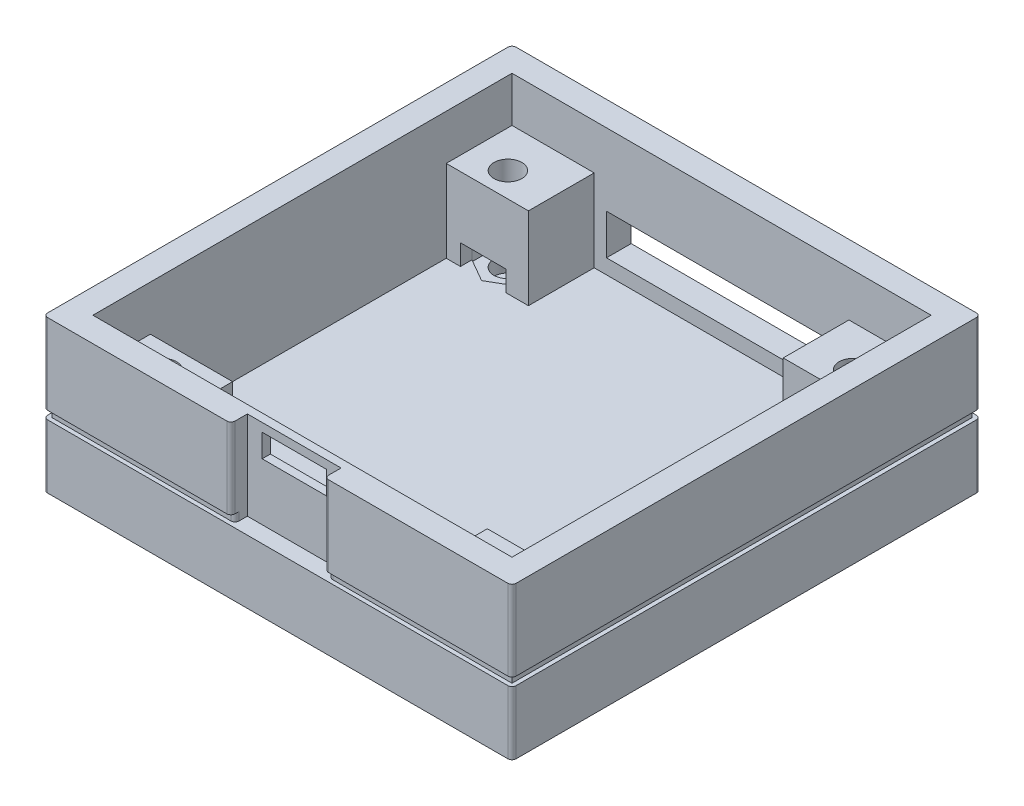
from build123d import *

# Parameters (mm, degrees)
ESQUISSE1_W              = 57
ESQUISSE1_H              = 57
BOSS_EXTRU_1_DEPTH       = 18.5
ESQUISSE2_W              = 51
ESQUISSE2_H              = 51
ENL_V_MAT_EXTRU_1_DEPTH  = 15.5
ESQUISSE4_W              = 10
ESQUISSE4_H              = 8
BOSS_EXTRU_2_DEPTH       = 10
ESQUISSE5_W              = 10
ESQUISSE5_H              = 8
BOSS_EXTRU_3_DEPTH       = 10
ESQUISSE6_W              = 10
ESQUISSE6_H              = 7
BOSS_EXTRU_4_DEPTH       = 10
ESQUISSE7_W              = 10
ESQUISSE7_H              = 7
BOSS_EXTRU_5_DEPTH       = 10
ESQUISSE8_R              = 1.7
ENL_V_MAT_EXTRU_2_DEPTH  = 12
ESQUISSE9_R              = 1.7
ENL_V_MAT_EXTRU_3_DEPTH  = 12
ESQUISSE16_R             = 1.7
ENL_V_MAT_EXTRU_9_DEPTH  = 12
ESQUISSE17_R             = 1.7
ENL_V_MAT_EXTRU_10_DEPTH = 12
ESQUISSE21_W             = 7.8
ESQUISSE21_H             = 2.8
ENL_V_MAT_EXTRU_14_DEPTH = 3
ENL_V_START              = -7.5
ENL_V_MAT_EXTRU_18_DEPTH = 2.7
ENL_V_MAT_EXTRU_20_DEPTH = 2.7
ESQUISSE26_W             = 5.54
ESQUISSE26_H             = 2.5
ENL_V_MAT_EXTRU_21_DEPTH = 2.847955181
ENL_V_MAT_EXTRU_22_DEPTH = 2.7
ENL_V_MAT_EXTRU_24_DEPTH = 2.7
ESQUISSE23_W             = 5.54
ESQUISSE23_H             = 2.5
ENL_V_MAT_EXTRU_26_DEPTH = 2
ESQUISSE31_W             = 5.54
ESQUISSE31_H             = 2.5
ENL_V_MAT_EXTRU_27_DEPTH = 2
ESQUISSE30_W             = 5.54
ESQUISSE30_H             = 2.5
ENL_V_MAT_EXTRU_28_DEPTH = 2
ESQUISSE32_W             = 57
ESQUISSE32_H             = 1
ENL_V_MAT_EXTRU_29_DEPTH = 0.5
ESQUISSE33_W             = 57
ESQUISSE33_H             = 1
ENL_V_MAT_EXTRU_30_DEPTH = 0.5
ESQUISSE34_W             = 57
ESQUISSE34_H             = 1
ENL_V_MAT_EXTRU_31_DEPTH = 0.5
ESQUISSE35_W             = 57
ESQUISSE35_H             = 1
ENL_V_MAT_EXTRU_32_DEPTH = 0.5
ESQUISSE36_W             = 11.4
ESQUISSE36_H             = 10.780005484
ENL_V_MAT_EXTRU_33_DEPTH = 2
CONG_1_R                 = 0.5
CONG_2_R                 = 0.5
CONG_3_R                 = 0.5
CONG_4_R                 = 0.5
CONG_5_R                 = 0.5
CONG_6_R                 = 0.5
CONG_7_R                 = 0.5
CONG_8_R                 = 0.5
CONG_9_R                 = 0.5
CONG_10_R                = 0.5
CONG_11_R                = 0.5
CONG_12_R                = 0.5
ESQUISSE38_W             = 28
ESQUISSE38_H             = 4.913001224
ENL_V_MAT_EXTRU_34_DEPTH = 3


with BuildPart() as part:
    # Esquisse1 → Boss.-Extru.1 (new body)
    with BuildSketch(Plane(origin=(0, 0, 0), x_dir=(1, 0, 0), z_dir=(0, 1, 0))):
        with Locations((-1.510072399, 8.394175698)):
            Rectangle(ESQUISSE1_W, ESQUISSE1_H)
    extrude(amount=BOSS_EXTRU_1_DEPTH)

    # Esquisse2 → Enlèv. mat.-Extru.1 (cut)
    with BuildSketch(Plane(origin=(0, 18.5, 0), x_dir=(1, 0, 0), z_dir=(0, 1, 0))):
        with Locations((-1.510072399, 8.394175698)):
            Rectangle(ESQUISSE2_W, ESQUISSE2_H)
    extrude(amount=-ENL_V_MAT_EXTRU_1_DEPTH, mode=Mode.SUBTRACT)

    # Esquisse4 → Boss.-Extru.2 (add)
    with BuildSketch(Plane(origin=(0, 3, 0), x_dir=(1, 0, 0), z_dir=(0, 1, 0))):
        with Locations((-22.010072399, 29.894175698)):
            Rectangle(ESQUISSE4_W, ESQUISSE4_H)
    extrude(amount=BOSS_EXTRU_2_DEPTH)

    # Esquisse5 → Boss.-Extru.3 (add)
    with BuildSketch(Plane(origin=(0, 3, 0), x_dir=(1, 0, 0), z_dir=(0, 1, 0))):
        with Locations((18.989927601, 29.894175698)):
            Rectangle(ESQUISSE5_W, ESQUISSE5_H)
    extrude(amount=BOSS_EXTRU_3_DEPTH)

    # Esquisse6 → Boss.-Extru.4 (add)
    with BuildSketch(Plane(origin=(0, 3, 0), x_dir=(1, 0, 0), z_dir=(0, 1, 0))):
        with Locations((18.989927601, -13.605824302)):
            Rectangle(ESQUISSE6_W, ESQUISSE6_H)
    extrude(amount=BOSS_EXTRU_4_DEPTH)

    # Esquisse7 → Boss.-Extru.5 (add)
    with BuildSketch(Plane(origin=(0, 3, 0), x_dir=(1, 0, 0), z_dir=(0, 1, 0))):
        with Locations((-22.010072399, -13.605824302)):
            Rectangle(ESQUISSE7_W, ESQUISSE7_H)
    extrude(amount=BOSS_EXTRU_5_DEPTH)

    # Esquisse8 → Enlèv. mat.-Extru.2 (cut)
    with BuildSketch(Plane(origin=(0, 13, 0), x_dir=(1, 0, 0), z_dir=(0, 1, 0))):
        with Locations(Location((19.489927601, -13.105824302, 0), (0, 0, 270))):
            Circle(ESQUISSE8_R)
    extrude(amount=-ENL_V_MAT_EXTRU_2_DEPTH, mode=Mode.SUBTRACT)

    # Esquisse9 → Enlèv. mat.-Extru.3 (cut)
    with BuildSketch(Plane(origin=(0, 13, 0), x_dir=(1, 0, 0), z_dir=(0, 1, 0))):
        with Locations(Location((-22.510072399, -13.105824302, 0), (0, 0, 270))):
            Circle(ESQUISSE9_R)
    extrude(amount=-ENL_V_MAT_EXTRU_3_DEPTH, mode=Mode.SUBTRACT)

    # Esquisse16 → Enlèv. mat.-Extru.9 (cut)
    with BuildSketch(Plane(origin=(0, 13, 0), x_dir=(1, 0, 0), z_dir=(0, 1, 0))):
        with Locations(Location((-22.510072399, 28.894175698, 0), (0, 0, 270))):
            Circle(ESQUISSE16_R)
    extrude(amount=-ENL_V_MAT_EXTRU_9_DEPTH, mode=Mode.SUBTRACT)

    # Esquisse17 → Enlèv. mat.-Extru.10 (cut)
    with BuildSketch(Plane(origin=(0, 13, 0), x_dir=(1, 0, 0), z_dir=(0, 1, 0))):
        with Locations(Location((19.489927601, 28.894175698, 0), (0, 0, 270))):
            Circle(ESQUISSE17_R)
    extrude(amount=-ENL_V_MAT_EXTRU_10_DEPTH, mode=Mode.SUBTRACT)

    # Esquisse21 → Enlèv. mat.-Extru.14 (cut)
    with BuildSketch(Plane.XY.offset(20.105824302)):
        with Locations((-1.510072399, 16.07)):
            Rectangle(ESQUISSE21_W, ESQUISSE21_H)
    extrude(amount=-ENL_V_MAT_EXTRU_14_DEPTH, mode=Mode.SUBTRACT)

    # Esquisse24 → Enlèv. mat.-Extru.18 (cut)
    with BuildSketch(Plane(origin=(0, 13, 0), x_dir=(1, 0, 0), z_dir=(0, 1, 0)).offset(ENL_V_START)):
        Polygon((19.489927601, 25.694175698), (22.261208893, 27.294175698), (22.261208893, 30.494175698), (19.489927601, 32.094175698), (16.718646309, 30.494175698), (16.718646309, 27.294175698), align=None)
    extrude(amount=-ENL_V_MAT_EXTRU_18_DEPTH, mode=Mode.SUBTRACT)

    # Esquisse25 → Enlèv. mat.-Extru.20 (cut)
    with BuildSketch(Plane(origin=(0, 13, 0), x_dir=(1, 0, 0), z_dir=(0, 1, 0)).offset(ENL_V_START)):
        Polygon((16.718646309, -11.505824302), (16.718646309, -14.705824302), (19.489927601, -16.305824302), (22.261208893, -14.705824302), (22.261208893, -11.505824302), (19.489927601, -9.905824302), align=None)
    extrude(amount=-ENL_V_MAT_EXTRU_20_DEPTH, mode=Mode.SUBTRACT)

    # Esquisse26 → Enlèv. mat.-Extru.21 (cut)
    with BuildSketch(Plane(origin=(0, 0, 10.105824302), x_dir=(-1, 0, 0), z_dir=(0, 0, -1))):
        with Locations((-19.489927601, 4.25)):
            Rectangle(ESQUISSE26_W, ESQUISSE26_H)
    extrude(amount=-ENL_V_MAT_EXTRU_21_DEPTH, mode=Mode.SUBTRACT)

    # Esquisse27 → Enlèv. mat.-Extru.22 (cut)
    with BuildSketch(Plane(origin=(0, 13, 0), x_dir=(1, 0, 0), z_dir=(0, 1, 0)).offset(ENL_V_START)):
        Polygon((-19.738791107, 27.294175698), (-19.738791107, 30.494175698), (-22.510072399, 32.094175698), (-25.281353691, 30.494175698), (-25.281353691, 27.294175698), (-22.510072399, 25.694175698), align=None)
    extrude(amount=-ENL_V_MAT_EXTRU_22_DEPTH, mode=Mode.SUBTRACT)

    # Esquisse29 → Enlèv. mat.-Extru.24 (cut)
    with BuildSketch(Plane(origin=(0, 13, 0), x_dir=(1, 0, 0), z_dir=(0, 1, 0)).offset(ENL_V_START)):
        Polygon((-19.738791107, -11.505824302), (-22.510072399, -9.905824302), (-25.281353691, -11.505824302), (-25.281353691, -14.705824302), (-22.510072399, -16.305824302), (-19.738791107, -14.705824302), align=None)
    extrude(amount=-ENL_V_MAT_EXTRU_24_DEPTH, mode=Mode.SUBTRACT)

    # Esquisse23 → Enlèv. mat.-Extru.26 (cut)
    with BuildSketch(Plane.XY.offset(-25.894175698)):
        with Locations((19.489927601, 4.25)):
            Rectangle(ESQUISSE23_W, ESQUISSE23_H)
    extrude(amount=-ENL_V_MAT_EXTRU_26_DEPTH, mode=Mode.SUBTRACT)

    # Esquisse31 → Enlèv. mat.-Extru.27 (cut)
    with BuildSketch(Plane.XY.offset(-25.894175698)):
        with Locations((-22.510072399, 4.25)):
            Rectangle(ESQUISSE31_W, ESQUISSE31_H)
    extrude(amount=-ENL_V_MAT_EXTRU_27_DEPTH, mode=Mode.SUBTRACT)

    # Esquisse30 → Enlèv. mat.-Extru.28 (cut)
    with BuildSketch(Plane(origin=(0, 0, 10.105824302), x_dir=(-1, 0, 0), z_dir=(0, 0, -1))):
        with Locations((22.510072399, 4.25)):
            Rectangle(ESQUISSE30_W, ESQUISSE30_H)
    extrude(amount=-ENL_V_MAT_EXTRU_28_DEPTH, mode=Mode.SUBTRACT)

    # Esquisse32 → Enlèv. mat.-Extru.29 (cut)
    with BuildSketch(Plane.ZY.offset(30.010072399)):
        with Locations((-8.394175698, 8.219994516)):
            Rectangle(ESQUISSE32_W, ESQUISSE32_H)
    extrude(amount=-ENL_V_MAT_EXTRU_29_DEPTH, mode=Mode.SUBTRACT)

    # Esquisse33 → Enlèv. mat.-Extru.30 (cut)
    with BuildSketch(Plane.XY.offset(20.105824302)):
        with Locations((-1.510072399, 8.219994516)):
            Rectangle(ESQUISSE33_W, ESQUISSE33_H)
    extrude(amount=-ENL_V_MAT_EXTRU_30_DEPTH, mode=Mode.SUBTRACT)

    # Esquisse34 → Enlèv. mat.-Extru.31 (cut)
    with BuildSketch(Plane(origin=(26.989927601, 0, 0), x_dir=(0, 0, -1), z_dir=(1, 0, 0))):
        with Locations((8.394175698, 8.219994516)):
            Rectangle(ESQUISSE34_W, ESQUISSE34_H)
    extrude(amount=-ENL_V_MAT_EXTRU_31_DEPTH, mode=Mode.SUBTRACT)

    # Esquisse35 → Enlèv. mat.-Extru.32 (cut)
    with BuildSketch(Plane(origin=(0, 0, -36.894175698), x_dir=(-1, 0, 0), z_dir=(0, 0, -1))):
        with Locations((1.510072399, 8.219994516)):
            Rectangle(ESQUISSE35_W, ESQUISSE35_H)
    extrude(amount=-ENL_V_MAT_EXTRU_32_DEPTH, mode=Mode.SUBTRACT)

    # Esquisse36 → Enlèv. mat.-Extru.33 (cut)
    with BuildSketch(Plane.XY.offset(20.105824302)):
        with Locations((-1.510072399, 13.109997258)):
            Rectangle(ESQUISSE36_W, ESQUISSE36_H)
    extrude(amount=-ENL_V_MAT_EXTRU_33_DEPTH, mode=Mode.SUBTRACT)

    # Congé1
    cong_1_edges = [part.edges().sort_by_distance(p)[0] for p in [
        (-7.210072399, 13.609997258, 20.105824302),
    ]]
    fillet(cong_1_edges, radius=CONG_1_R)

    # Congé2
    cong_2_edges = [part.edges().sort_by_distance(p)[0] for p in [
        (4.189927601, 13.609997258, 20.105824302),
    ]]
    fillet(cong_2_edges, radius=CONG_2_R)

    # Congé3
    cong_3_edges = [part.edges().sort_by_distance(p)[0] for p in [
        (-7.210072399, 8.219994516, 19.605824302),
    ]]
    fillet(cong_3_edges, radius=CONG_3_R)

    # Congé4
    cong_4_edges = [part.edges().sort_by_distance(p)[0] for p in [
        (4.189927601, 8.219994516, 19.605824302),
    ]]
    fillet(cong_4_edges, radius=CONG_4_R)

    # Congé5
    cong_5_edges = [part.edges().sort_by_distance(p)[0] for p in [
        (26.989927601, 13.609997258, 20.105824302),
    ]]
    fillet(cong_5_edges, radius=CONG_5_R)

    # Congé6
    cong_6_edges = [part.edges().sort_by_distance(p)[0] for p in [
        (26.989927601, 3.859997258, 20.105824302),
    ]]
    fillet(cong_6_edges, radius=CONG_6_R)

    # Congé7
    cong_7_edges = [part.edges().sort_by_distance(p)[0] for p in [
        (26.989927601, 13.609997258, -36.894175698),
    ]]
    fillet(cong_7_edges, radius=CONG_7_R)

    # Congé8
    cong_8_edges = [part.edges().sort_by_distance(p)[0] for p in [
        (26.989927601, 3.859997258, -36.894175698),
    ]]
    fillet(cong_8_edges, radius=CONG_8_R)

    # Congé9
    cong_9_edges = [part.edges().sort_by_distance(p)[0] for p in [
        (-30.010072399, 13.609997258, -36.894175698),
    ]]
    fillet(cong_9_edges, radius=CONG_9_R)

    # Congé10
    cong_10_edges = [part.edges().sort_by_distance(p)[0] for p in [
        (-30.010072399, 3.859997258, -36.894175698),
    ]]
    fillet(cong_10_edges, radius=CONG_10_R)

    # Congé11
    cong_11_edges = [part.edges().sort_by_distance(p)[0] for p in [
        (-30.010072399, 13.609997258, 20.105824302),
    ]]
    fillet(cong_11_edges, radius=CONG_11_R)

    # Congé12
    cong_12_edges = [part.edges().sort_by_distance(p)[0] for p in [
        (-30.010072399, 3.859997258, 20.105824302),
    ]]
    fillet(cong_12_edges, radius=CONG_12_R)

    # Esquisse38 → Enlèv. mat.-Extru.34 (cut)
    with BuildSketch(Plane(origin=(0, 0, -36.894175698), x_dir=(-1, 0, 0), z_dir=(0, 0, -1))):
        with Locations((1.510072399, 7.254987661)):
            Rectangle(ESQUISSE38_W, ESQUISSE38_H)
    extrude(amount=-ENL_V_MAT_EXTRU_34_DEPTH, mode=Mode.SUBTRACT)


solid = part.part
